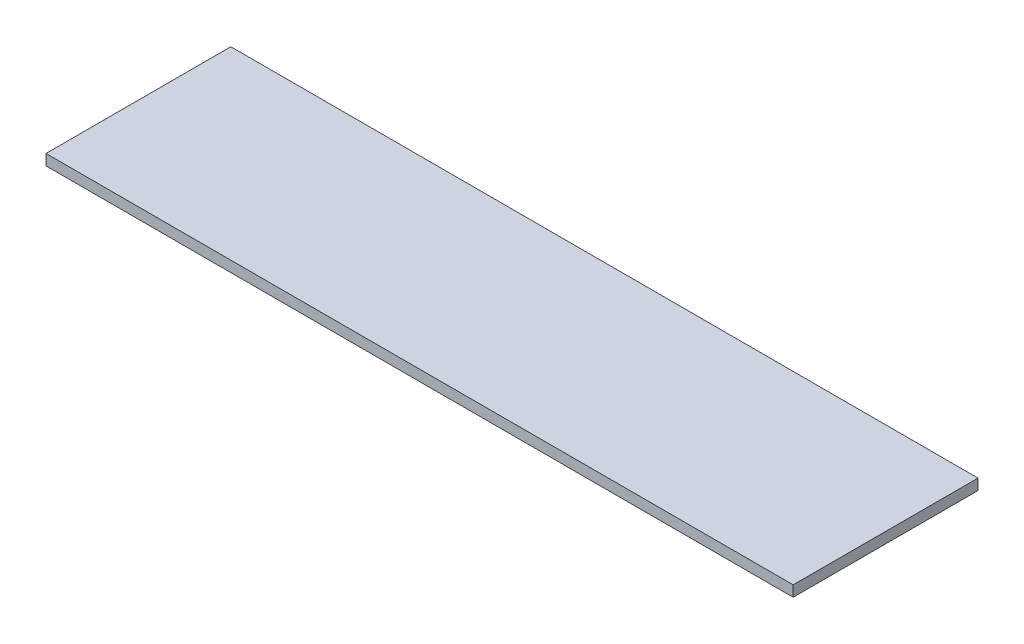
from build123d import *

# Parameters (mm, degrees)
SKETCH1_W           = 138.45
SKETCH1_H           = 34.25
BOSS_EXTRUDE1_DEPTH = 2


with BuildPart() as part:
    # Sketch1 → Boss-Extrude1 (new body)
    with BuildSketch(Plane(origin=(0, 0, 0), x_dir=(1, 0, 0), z_dir=(0, 1, 0))):
        with Locations((69.225, 17.125)):
            Rectangle(SKETCH1_W, SKETCH1_H)
    extrude(amount=BOSS_EXTRUDE1_DEPTH)


solid = part.part
